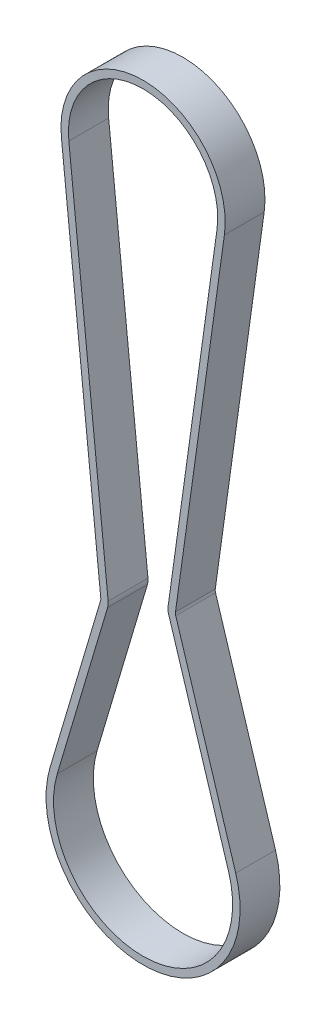
from build123d import *

# Parameters (mm, degrees)
EXTRUDE_1_DEPTH = 8


with BuildPart() as part:
    # 草图1 → 凸台-拉伸1 (new body)
    with BuildSketch(Plane.XY):
        with BuildLine():
            Line((-16.411815913, 74.600371351), (-8.508016735, -1.541141365))
            ThreePointArc((-8.508016735, -1.541141365), (-8.506481222, -1.835305148), (-8.562386235, -2.124111864))
            Line((-8.562386235, -2.124111864), (-18.68897894, -36.13076004))
            ThreePointArc((-18.68897894, -36.13076004), (0.117281622, -61.19566261), (18.620684248, -35.906359171))
            Line((18.620684248, -35.906359171), (6.567639673, 2.858626531))
            ThreePointArc((6.567639673, 2.858626531), (6.504977271, 3.181890311), (6.514359049, 3.511037742))
            Line((6.514359049, 3.511037742), (16.342050463, 74.026401184))
            ThreePointArc((16.342050463, 74.026401184), (0.289097289, 92.801451857), (-16.411815913, 74.600371351))
        make_face()
        with BuildLine():
            Line((-14.919832648, 74.755245291), (-7.01603347, -1.386267424))
            ThreePointArc((-7.01603347, -1.386267424), (-7.012962444, -1.974594991), (-7.124772471, -2.552208423))
            Line((-7.124772471, -2.552208423), (-17.251365176, -36.558856599))
            ThreePointArc((-17.251365176, -36.558856599), (0.108259958, -59.69568974), (17.188323921, -36.351717335))
            Line((17.188323921, -36.351717335), (5.135279347, 2.413268367))
            ThreePointArc((5.135279347, 2.413268367), (5.009954541, 3.059795928), (5.028718098, 3.718090788))
            Line((5.028718098, 3.718090788), (14.856409512, 74.233454231))
            ThreePointArc((14.856409512, 74.233454231), (0.262815717, 91.301682115), (-14.919832648, 74.755245291))
        make_face(mode=Mode.SUBTRACT)
    extrude(amount=EXTRUDE_1_DEPTH)


solid = part.part
